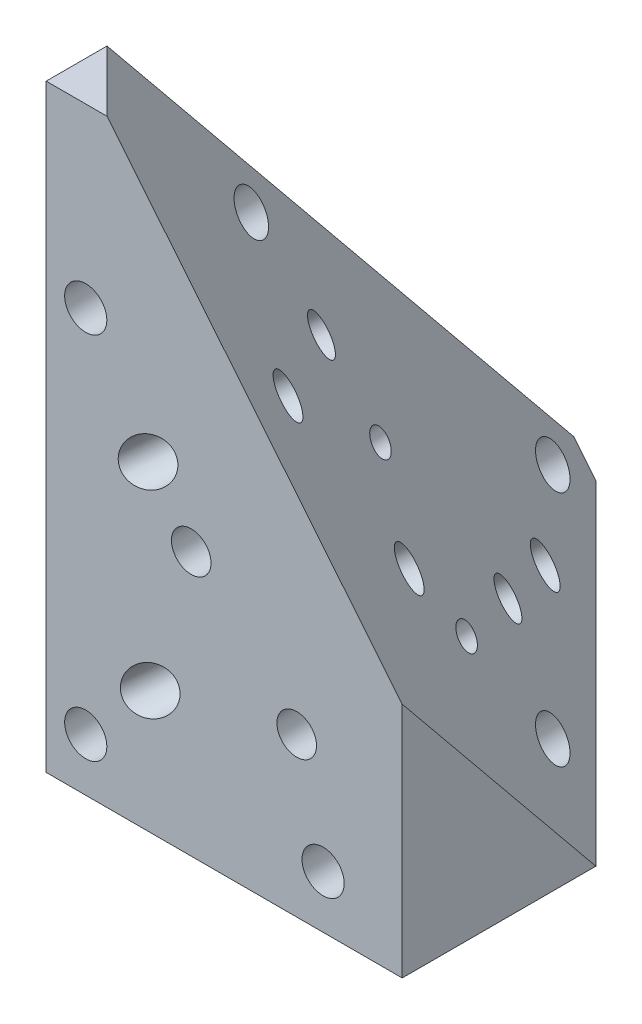
from build123d import *

# Parameters (mm, degrees)
SKETCH1_W                       = 13.5
SKETCH1_H                       = 20
BOSS_EXTRUDE1_DEPTH             = 22.7
SKETCH2_W                       = 50.012416784
SKETCH2_H                       = 57.752903126
CUT_EXTRUDE1_DEPTH              = 22.813888303
M2X0_4_TAPPED_HOLE1_D           = 1.6
M2X0_4_TAPPED_HOLE1_ON_FACE_2_D = 1.6
M2X0_4_TAPPED_HOLE1_ON_FACE_3_D = 1.6
M2X0_4_TAPPED_HOLE3_D           = 1.6
F_1_0MM_DOWEL_HOLE1_D           = 1
F_1_5MM_DOWEL_HOLE1_D           = 1.5
F_1_5MM_DOWEL_HOLE1_DEPTH       = 4.5
F_1_5MM_DOWEL_HOLE1_TIP         = 0.450645464
F_1_0MM_DOWEL_HOLE2_D           = 1
F_1_0MM_DOWEL_HOLE2_ON_FACE_2_D = 1
F_1_5MM_DOWEL_HOLE2_D           = 1.5
F_1_5MM_DOWEL_HOLE2_DEPTH       = 3.5
F_1_5MM_DOWEL_HOLE2_TIP         = 0.450645464


with BuildPart() as part:
    # Sketch1 → Boss-Extrude1 (new body)
    with BuildSketch(Plane(origin=(0, 0, 0), x_dir=(1, 0, 0), z_dir=(0, 1, 0))):
        with Locations((6.75, 10)):
            Rectangle(SKETCH1_W, SKETCH1_H)
    extrude(amount=BOSS_EXTRUDE1_DEPTH)

    # Sketch2 → Cut-Extrude1 (cut, through all)
    with BuildSketch(Plane(origin=(7.815425957, 6.381268572, -7.815425957), x_dir=(0.7905694150420965, -0.3872983346207431, 0.4743416490252531), z_dir=(-0.6123724356957925, -0.5000000000000046, 0.6123724356957929))):
        Rectangle(SKETCH2_W, SKETCH2_H)
    extrude(amount=-CUT_EXTRUDE1_DEPTH, mode=Mode.SUBTRACT)

    # M2x0.4 Tapped Hole1 (through all)
    with Locations(Plane(origin=(6.5161982, 14.294607438, -2.653439586), x_dir=(-0.707106781187, 0, -0.707106781187), z_dir=(0.612372435696, 0.5, -0.612372435696))):
        with Locations((0, 0)):
            Hole(M2X0_4_TAPPED_HOLE1_D / 2)

    # M2x0.4 Tapped Hole1 on face 2 (through all)
    with Locations(Plane(origin=(8.855545244, 8.665670048, -4.910100675), x_dir=(-0.707106781187, 0, -0.707106781187), z_dir=(0.612372326772, 0.500000266808, -0.612372326772))):
        with Locations((0, 0)):
            Hole(M2X0_4_TAPPED_HOLE1_ON_FACE_2_D / 2)

    # M2x0.4 Tapped Hole1 on face 3 (through all)
    with Locations(Plane(origin=(5.007385282, 2.349364905, -13.91550219), x_dir=(-0.707106781187, 0, -0.707106781187), z_dir=(0.612372326772, 0.500000266808, -0.612372326772))):
        with Locations((0, 0)):
            Hole(M2X0_4_TAPPED_HOLE1_ON_FACE_3_D / 2)

    # M2x0.4 Tapped Hole3 (through all)
    with Locations(Plane(origin=(1.5, 16, 0), x_dir=(1, 0, 0), z_dir=(0, 0, 1))):
        with Locations((0, 0), (0, -14), (9, -14)):
            Hole(M2X0_4_TAPPED_HOLE3_D / 2)

    # Ø1.0mm Dowel Hole1 (through all)
    with Locations(Plane(origin=(5.5, 10, 0), x_dir=(1, 0, 0), z_dir=(0, 0, 1))):
        with Locations((0, 0), (4, -4)):
            Hole(F_1_0MM_DOWEL_HOLE1_D / 2)

    # Ø1.5mm Dowel Hole1
    with Locations(Plane(origin=(5.5, 10, 0), x_dir=(1, 0, 0), z_dir=(0, 0, 1))):
        with Locations((0, 0), (4, -4)):
            Hole(F_1_5MM_DOWEL_HOLE1_D / 2, depth=F_1_5MM_DOWEL_HOLE1_DEPTH)
            with Locations((0, 0, -(F_1_5MM_DOWEL_HOLE1_DEPTH + F_1_5MM_DOWEL_HOLE1_TIP / 2))):  # 118° drill point
                Cone(0, F_1_5MM_DOWEL_HOLE1_D / 2, F_1_5MM_DOWEL_HOLE1_TIP, mode=Mode.SUBTRACT)

    # Ø1.0mm Dowel Hole2 (through all)
    with Locations(Plane(origin=(3.59317172, 12.741669751, -6.844434378), x_dir=(-0.707106781187, 0, -0.707106781187), z_dir=(0.612372435696, 0.5, -0.612372435696))):
        with Locations((0, 0)):
            Hole(F_1_0MM_DOWEL_HOLE2_D / 2)

    # Ø1.0mm Dowel Hole2 on face 2 (through all)
    with Locations(Plane(origin=(7.128705626, 4.081415713, -10.379968284), x_dir=(-0.707106781187, 0, -0.707106781187), z_dir=(0.612372326772, 0.500000266808, -0.612372326772))):
        with Locations((0, 0)):
            Hole(F_1_0MM_DOWEL_HOLE2_ON_FACE_2_D / 2)

    # Ø1.5mm Dowel Hole2
    with Locations(Plane(origin=(3.59317172, 12.741669751, -6.844434378), x_dir=(-0.707106781187, 0, -0.707106781187), z_dir=(0.612372435696, 0.5, -0.612372435696))):
        with Locations((0, 0), (0, -10)):
            Hole(F_1_5MM_DOWEL_HOLE2_D / 2, depth=F_1_5MM_DOWEL_HOLE2_DEPTH)
            with Locations((0, 0, -(F_1_5MM_DOWEL_HOLE2_DEPTH + F_1_5MM_DOWEL_HOLE2_TIP / 2))):  # 118° drill point
                Cone(0, F_1_5MM_DOWEL_HOLE2_D / 2, F_1_5MM_DOWEL_HOLE2_TIP, mode=Mode.SUBTRACT)


solid = part.part
